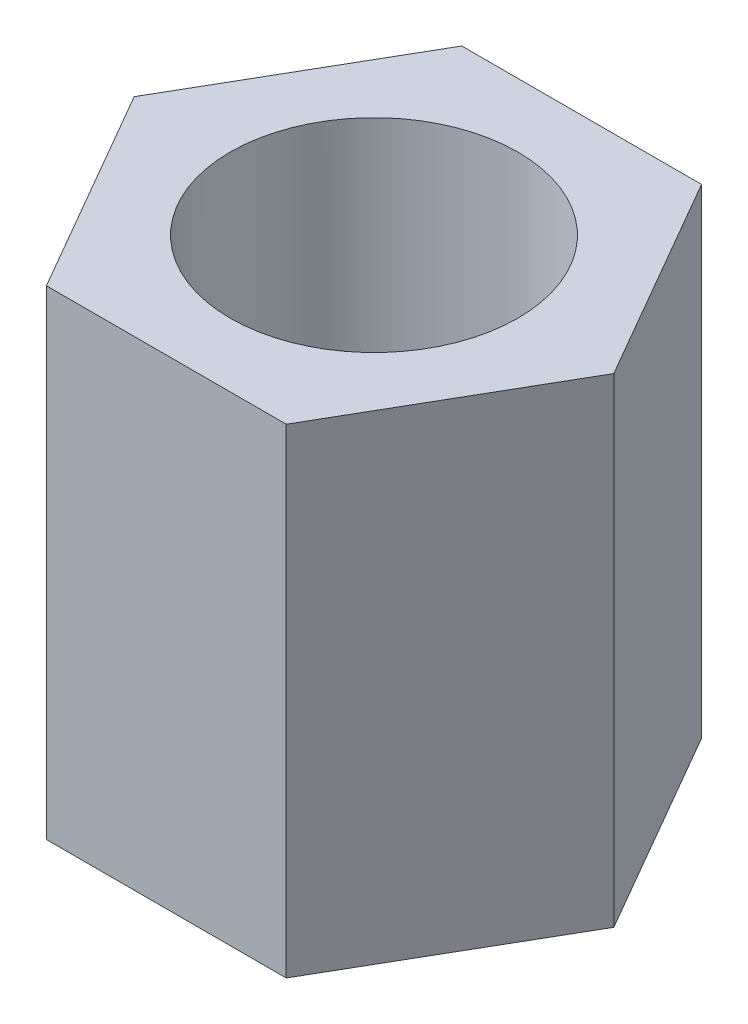
from build123d import *

# Parameters (mm, degrees)
EXTRUDE_1_DEPTH     = 5
SKETCH_2_R          = 1.5
EXTRUDE_2_DEPTH     = 5
SKETCH_3_R          = 1.5
CUT_EXTRUDE_1_DEPTH = 10


with BuildPart() as part:
    # Эскиз1 → Бобышка-Вытянуть1 (new body)
    with BuildSketch(Plane(origin=(0, 0, 0), x_dir=(1, 0, 0), z_dir=(0, 1, 0))):
        Polygon((1.25, -2.165063509), (2.5, 0), (1.25, 2.165063509), (-1.25, 2.165063509), (-2.5, 0), (-1.25, -2.165063509), align=None)
    extrude(amount=EXTRUDE_1_DEPTH)

    # Эскиз2 → Бобышка-Вытянуть2 (add)
    with BuildSketch(Plane(origin=(0, 5, 0), x_dir=(1, 0, 0), z_dir=(0, 1, 0))):
        with Locations(Location((0, 0, 0), (0, 0, 270))):
            Circle(SKETCH_2_R)
    extrude(amount=EXTRUDE_2_DEPTH)

    # Эскиз3 → Вырез-Вытянуть1 (cut)
    with BuildSketch(Plane.XZ):
        with Locations(Location((0, 0, 0), (0, 0, 270))):
            Circle(SKETCH_3_R)
    extrude(amount=-CUT_EXTRUDE_1_DEPTH, mode=Mode.SUBTRACT)


solid = part.part
